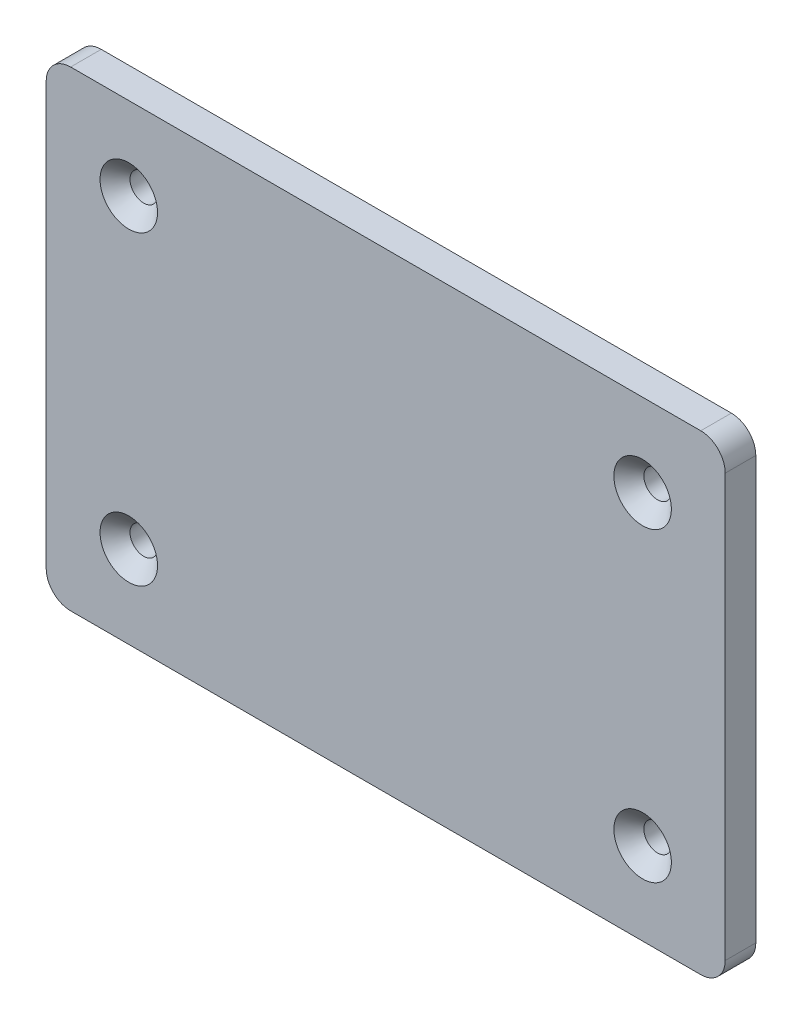
from build123d import *

# Parameters (mm, degrees)
SKETCH_1_W                   = 111
SKETCH_1_H                   = 77
SKETCH_1_R                   = 2
EXTRUDE_1_DEPTH              = 5
SKETCH_2_W                   = 108
SKETCH_2_H                   = 74
SKETCH_2_W_2                 = 94
SKETCH_2_H_2                 = 60
CUT_EXTRUDE_1_DEPTH          = 4.5
CUT_EXTRUDE_2_DEPTH          = 4
FILLET_1_R                   = 4
HOLE_WIZARD_M4_1_D           = 4.5
HOLE_WIZARD_M4_1_CSINK_D     = 9.4
HOLE_WIZARD_M4_1_CSINK_ANGLE = 90


with BuildPart() as part:
    # ｽｹｯﾁ1 → ﾎﾞｽ - 押し出し1 (new body)
    with BuildSketch(Plane.XY):
        with Locations((0, -6)):
            Rectangle(SKETCH_1_W, SKETCH_1_H)
        with Locations((-42, 19)):
            Circle(SKETCH_1_R, mode=Mode.SUBTRACT)
        with Locations(Location((42, 19, 0), (0, 0, 180))):
            Circle(SKETCH_1_R, mode=Mode.SUBTRACT)
        with Locations((42, -31)):
            Circle(SKETCH_1_R, mode=Mode.SUBTRACT)
        with Locations(Location((-42, -31, 0), (0, 0, 180))):
            Circle(SKETCH_1_R, mode=Mode.SUBTRACT)
    extrude(amount=EXTRUDE_1_DEPTH)

    # ｽｹｯﾁ2 → ｶｯﾄ - 押し出し1 (cut)
    with BuildSketch(Plane(origin=(0, 0, 0), x_dir=(-1, 0, 0), z_dir=(0, 0, -1))):
        with Locations((0, -6)):
            Rectangle(SKETCH_2_W, SKETCH_2_H)
        with Locations((0, -6)):
            Rectangle(SKETCH_2_W_2, SKETCH_2_H_2, mode=Mode.SUBTRACT)
    extrude(amount=-CUT_EXTRUDE_1_DEPTH, mode=Mode.SUBTRACT)

    # ｽｹｯﾁ3 → ｶｯﾄ - 押し出し2 (cut)
    with BuildSketch(Plane(origin=(0, 0, 0), x_dir=(-1, 0, 0), z_dir=(0, 0, -1))):
        with BuildLine():
            Line((-37, -31), (37, -31))
            ThreePointArc((37, -31), (38.464466094, -27.464466094), (42, -26))
            Line((42, -26), (42, 14))
            ThreePointArc((42, 14), (38.464466094, 15.464466094), (37, 19))
            Line((37, 19), (-37, 19))
            ThreePointArc((-37, 19), (-38.464466094, 15.464466094), (-42, 14))
            Line((-42, 14), (-42, -26))
            ThreePointArc((-42, -26), (-38.464466094, -27.464466094), (-37, -31))
        make_face()
    extrude(amount=-CUT_EXTRUDE_2_DEPTH, mode=Mode.SUBTRACT)

    # ﾌｨﾚｯﾄ1
    fillet_1_edges = [part.edges().sort_by_distance(p)[0] for p in [
        (-54, -43, 2.25),
        (54, -43, 2.25),
        (54, 31, 2.25),
        (-54, 31, 2.25),
        (47, -36, 2.25),
        (47, 24, 2.25),
        (-47, 24, 2.25),
        (-47, -36, 2.25),
        (-37, 19, 2),
        (-42, 14, 2),
        (-42, -26, 2),
        (-37, -31, 2),
        (37, -31, 2),
        (42, -26, 2),
        (42, 14, 2),
        (37, 19, 2),
        (-55.5, -44.5, 2.5),
        (-55.5, 32.5, 2.5),
        (55.5, 32.5, 2.5),
        (55.5, -44.5, 2.5),
    ]]
    fillet(fillet_1_edges, radius=FILLET_1_R)

    # M4 丸皿ねじ用皿穴1 (through all)
    with Locations(Plane.XY.offset(5)):
        with Locations((-42, 19), (-42, -31), (42, -31), (42, 19)):
            CounterSinkHole(HOLE_WIZARD_M4_1_D / 2, HOLE_WIZARD_M4_1_CSINK_D / 2, counter_sink_angle=HOLE_WIZARD_M4_1_CSINK_ANGLE)


solid = part.part
